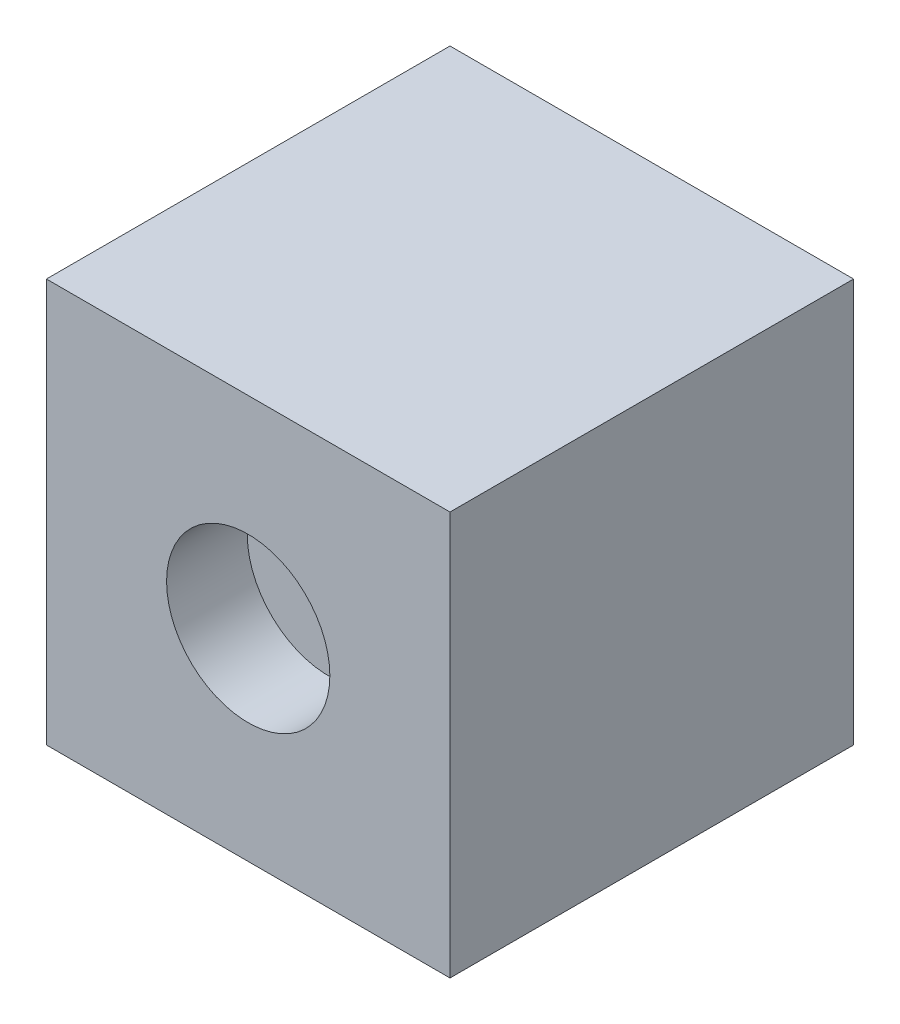
from build123d import *

# Parameters (mm, degrees)
SKETCH1_W           = 50
SKETCH1_H           = 50
BOSS_EXTRUDE1_DEPTH = 50
SKETCH2_R           = 10.114015562
CUT_EXTRUDE1_DEPTH  = 10


with BuildPart() as part:
    # Sketch1 → Boss-Extrude1 (new body)
    with BuildSketch(Plane.XY):
        Rectangle(SKETCH1_W, SKETCH1_H)
    extrude(amount=BOSS_EXTRUDE1_DEPTH)

    # Sketch2 → Cut-Extrude1 (cut)
    with BuildSketch(Plane.XY.offset(50)):
        Circle(SKETCH2_R)
    extrude(amount=-CUT_EXTRUDE1_DEPTH, mode=Mode.SUBTRACT)


solid = part.part
